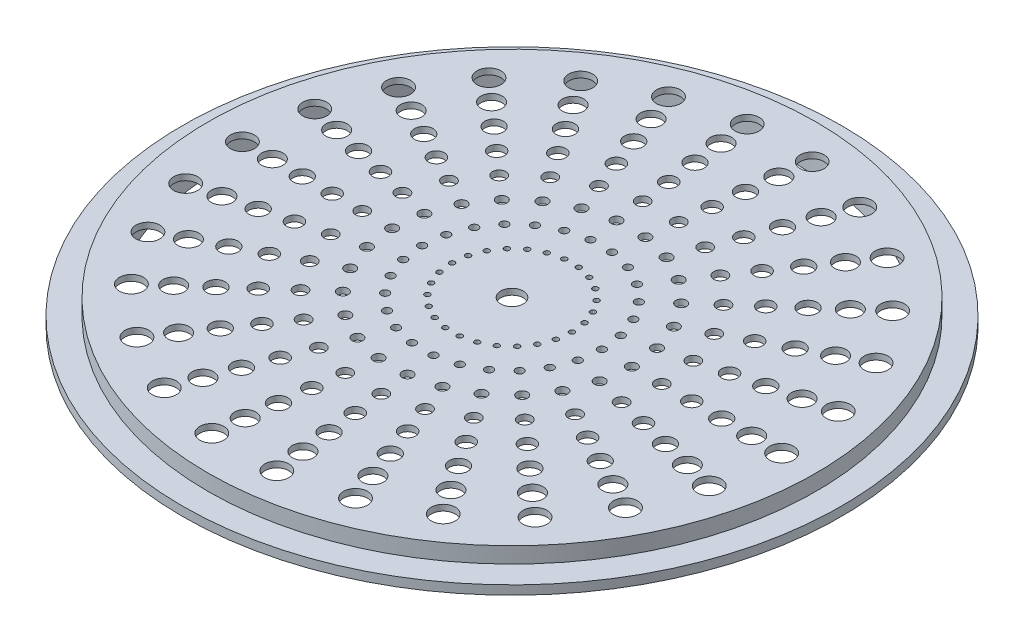
from build123d import *

# Parameters (mm, degrees)
SKETCH2_R          = 5.08
SKETCH2_R_2        = 4.511102344
SKETCH2_R_3        = 3.947214551
SKETCH2_R_4        = 3.383326758
SKETCH2_R_5        = 2.819438965
SKETCH2_R_6        = 2.255551172
SKETCH2_R_7        = 1.691663379
SKETCH2_R_8        = 1.127775586
CUT_EXTRUDE1_DEPTH = 198.933686433
CIRPATTERN1_COUNT  = 26
SKETCH3_R          = 4.7625
CUT_EXTRUDE2_DEPTH = 198.933686433


with BuildPart() as part:
    # Sketch1 → Revolve1 (revolve)
    with BuildSketch(Plane.XY, mode=Mode.PRIVATE) as revolve1_sk:
        Polygon((-121.285, 0), (-128.905, 0), (-128.905, 1.524), (-139.7, 1.524), (-139.7, 5.334), (-128.905, 5.334), (-128.905, 12.065), (0, 12.065), (0, 9.525), (-121.285, 9.525), align=None)
    revolve(revolve1_sk.sketch.rotate(Axis((0, 0, 0), (0, 1, 0)), 270), axis=Axis((0, 0, 0), (0, 1, 0)))

    # Sketch2 → Cut-Extrude1 (cut, through all)
    with BuildSketch(Plane(origin=(0, 12.065, 0), x_dir=(1, 0, 0), z_dir=(0, 1, 0))):
        with Locations(Location((-114.3, 0, 0), (0, 0, 270))):
            Circle(SKETCH2_R)
        with Locations(Location((-101.6, 0, 0), (0, 0, 270))):
            Circle(SKETCH2_R_2)
        with Locations(Location((-88.9, 0, 0), (0, 0, 270))):
            Circle(SKETCH2_R_3)
        with Locations(Location((-76.2, 0, 0), (0, 0, 270))):
            Circle(SKETCH2_R_4)
        with Locations(Location((-63.5, 0, 0), (0, 0, 270))):
            Circle(SKETCH2_R_5)
        with Locations(Location((-50.8, 0, 0), (0, 0, 270))):
            Circle(SKETCH2_R_6)
        with Locations(Location((-38.1, 0, 0), (0, 0, 270))):
            Circle(SKETCH2_R_7)
        with Locations(Location((-25.4, 0, 0), (0, 0, 270))):
            Circle(SKETCH2_R_8)
    cut_extrude1 = extrude(amount=-CUT_EXTRUDE1_DEPTH, mode=Mode.SUBTRACT)

    # CirPattern1: Cut-Extrude1 ×26 about axis
    cirpattern1_axis = Axis((0, 0, 0), (0, 1, 0))
    for i in range(1, CIRPATTERN1_COUNT):
        add(cut_extrude1.rotate(cirpattern1_axis, i * 360 / CIRPATTERN1_COUNT), mode=Mode.SUBTRACT)

    # Sketch3 → Cut-Extrude2 (cut, through all)
    with BuildSketch(Plane(origin=(0, 12.065, 0), x_dir=(1, 0, 0), z_dir=(0, 1, 0))):
        with Locations(Location((0, 0, 0), (0, 0, 270))):
            Circle(SKETCH3_R)
    extrude(amount=-CUT_EXTRUDE2_DEPTH, mode=Mode.SUBTRACT)


solid = part.part
